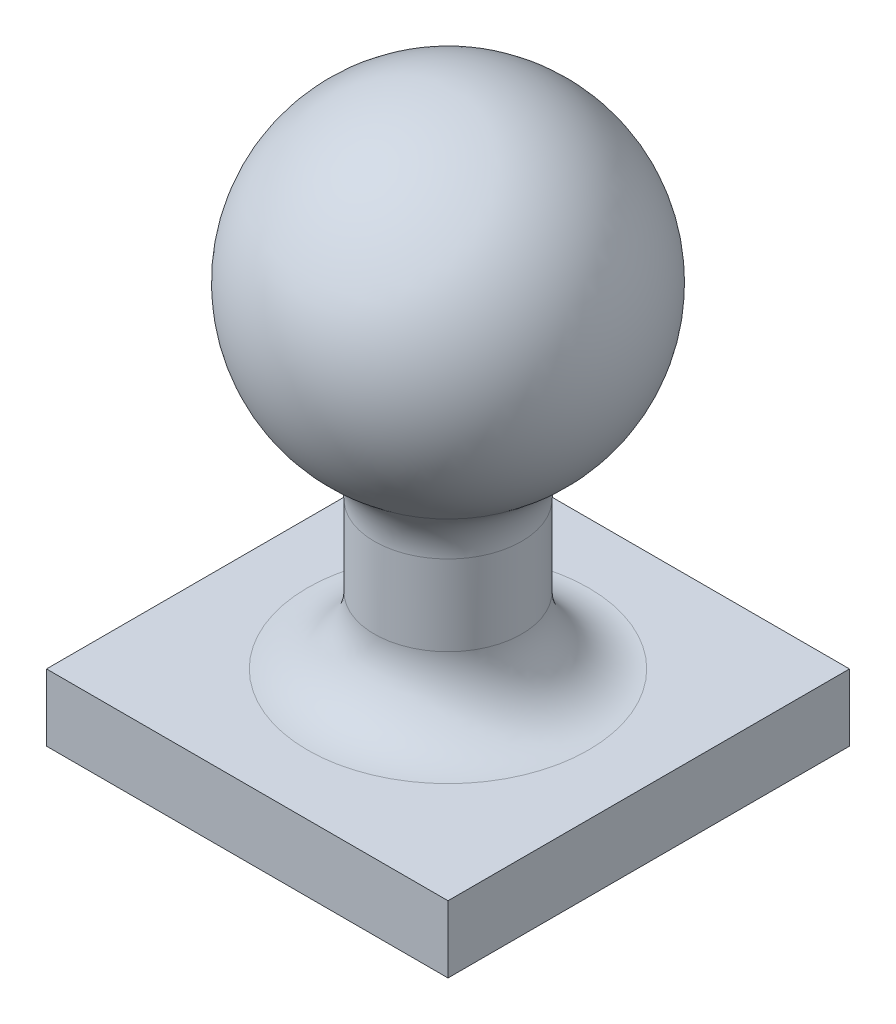
from build123d import *

# Parameters (mm, degrees)
SKETCH2_W           = 30.48
SKETCH2_H           = 30.48
BOSS_EXTRUDE1_DEPTH = 5.08
SKETCH3_R           = 5.588
BOSS_EXTRUDE2_DEPTH = 25.4
FILLET1_R           = 5.08


with BuildPart() as part:
    # Sketch2 → Boss-Extrude1 (new body)
    with BuildSketch(Plane(origin=(0, 0, 0), x_dir=(1, 0, 0), z_dir=(0, 1, 0))):
        with Locations((15.24, 15.24)):
            Rectangle(SKETCH2_W, SKETCH2_H)
    extrude(amount=BOSS_EXTRUDE1_DEPTH)

    # Sketch3 → Boss-Extrude2 (add)
    with BuildSketch(Plane(origin=(0, 5.08, 0), x_dir=(1, 0, 0), z_dir=(0, 1, 0))):
        with Locations(Location((15.24, 15.24, 0), (0, 0, 270))):
            Circle(SKETCH3_R)
    extrude(amount=BOSS_EXTRUDE2_DEPTH)

    # Sketch6 → Revolve1 (revolve)
    with BuildSketch(Plane(origin=(0, 30.48, 0), x_dir=(1, 0, 0), z_dir=(0, 1, 0))):
        with BuildLine():
            Line((15.24, 27.94), (15.24, 2.54))
            ThreePointArc((15.24, 2.54), (27.94, 15.24), (15.24, 27.94))
        make_face()
    revolve(axis=Axis((15.24, 30.48, -27.94), (0, 0, 1)))

    # Fillet1
    fillet1_edges = [part.edges().sort_by_distance(p)[0] for p in [
        (15.24, 5.08, -20.828),
        (15.24, 19.075428285, -20.828),
    ]]
    fillet(fillet1_edges, radius=FILLET1_R)


solid = part.part
